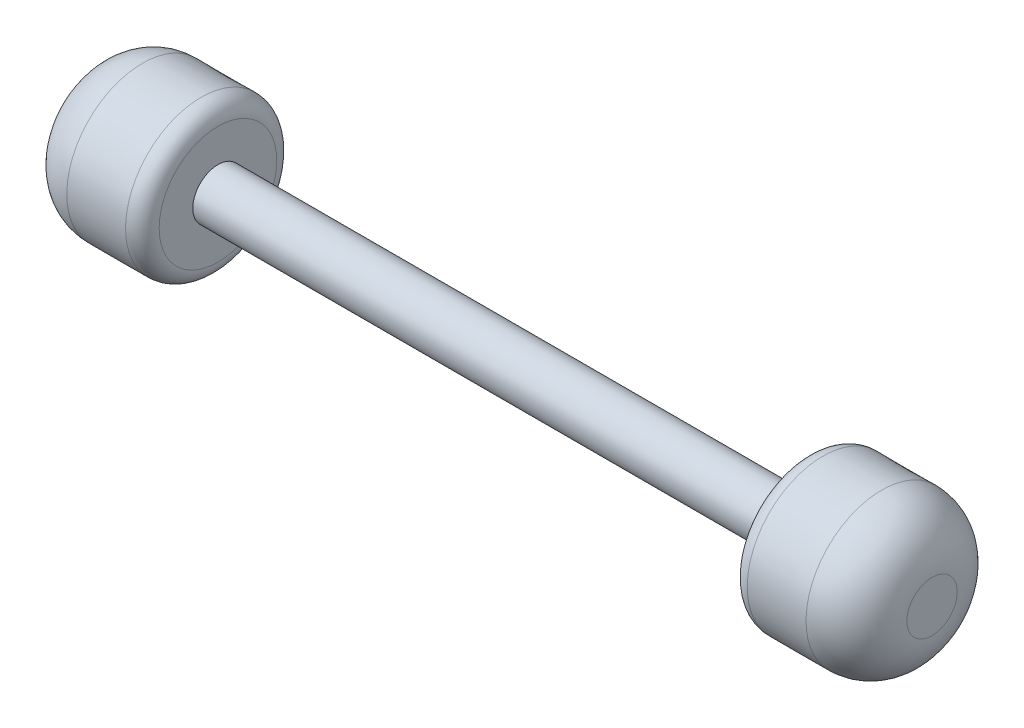
from build123d import *

# Parameters (mm, degrees)
SKETCH1_W = 70
SKETCH1_H = 3


with BuildPart() as part:
    # Sketch1 → Revolve1 (revolve)
    with BuildSketch(Plane.XY, mode=Mode.PRIVATE) as revolve1_sk:
        Rectangle(SKETCH1_W, SKETCH1_H)
    revolve(revolve1_sk.sketch.rotate(Axis((-35, 1.5, 0), (1, 0, 0)), 270), axis=Axis((-35, 1.5, 0), (1, 0, 0)))

    # Sketch2 → Revolve2 (revolve)
    with BuildSketch(Plane.XY, mode=Mode.PRIVATE) as revolve2_sk:
        Polygon((-44, 1.445289322), (-37, 1.445736138), (-37, 10.445863799), (-44, 10.445863799), align=None)
        with BuildLine():
            Line((-37, 10.445863799), (-37, 1.445736138))
            Line((-37, 1.445736138), (-35, 1.445863799))
            Line((-35, 1.445863799), (-35, 8.445863799))
            ThreePointArc((-35, 8.445863799), (-35.585786438, 9.860077362), (-37, 10.445863799))
        make_face()
        with BuildLine():
            Line((-50, 1.444906337), (-44, 1.445289322))
            Line((-44, 1.445289322), (-44, 10.445863799))
            ThreePointArc((-44, 10.445863799), (-48.242640687, 8.688504486), (-50, 4.445863799))
            Line((-50, 4.445863799), (-50, 1.444906337))
        make_face()
    revolve2 = revolve(revolve2_sk.sketch.rotate(Axis((-50, 1.444906337, 0), (0.9999999979628139, 6.383080945348042e-05, 0)), 180), axis=Axis((-50, 1.444906337, 0), (0.9999999979628139, 6.383080945348042e-05, 0)))

    # Mirror1: Revolve2 across plane
    add(revolve2.mirror(Plane(origin=(0, 0, 0), x_dir=(0, 0, 1), z_dir=(1, 0, 0))))


solid = part.part
